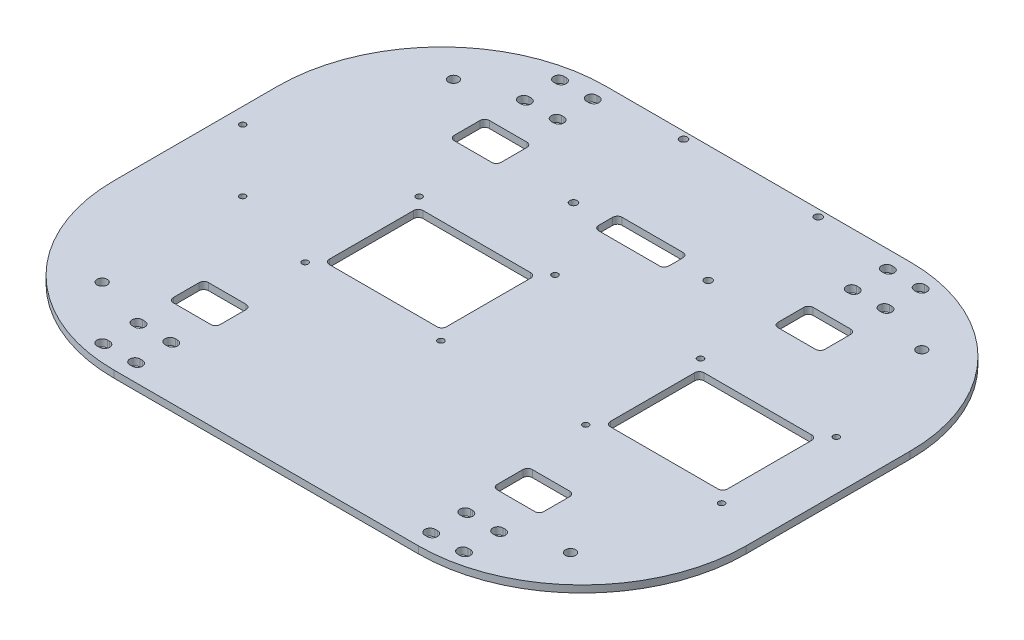
from build123d import *

# Parameters (mm, degrees)
SKETCH_1_W          = 270
SKETCH_1_H          = 210
EXTRUDE_1_DEPTH     = 3
SKETCH_2_R          = 2.15
CUT_EXTRUDE_1_DEPTH = 3
CUT_EXTRUDE_2_DEPTH = 10
SKETCH_4_W          = 20
SKETCH_4_H          = 15
CUT_EXTRUDE_3_DEPTH = 10
SKETCH_5_R          = 1.3
SKETCH_5_R_2        = 1.6
SKETCH_5_W          = 30
SKETCH_5_H          = 10
CUT_EXTRUDE_4_DEPTH = 10
CUT_EXTRUDE_5_DEPTH = 10
SKETCH_7_W          = 50
SKETCH_7_H          = 40
CUT_EXTRUDE_6_DEPTH = 10
FILLET_1_R          = 2


with BuildPart() as part:
    # 草图1 → 凸台-拉伸1 (new body)
    with BuildSketch(Plane(origin=(0, 0, 0), x_dir=(1, 0, 0), z_dir=(0, 1, 0))):
        Rectangle(SKETCH_1_W, SKETCH_1_H)
    extrude(amount=EXTRUDE_1_DEPTH)

    # 草图2 → 切除-拉伸1 (cut)
    with BuildSketch(Plane(origin=(0, 3, 0), x_dir=(1, 0, 0), z_dir=(0, 1, 0))):
        with Locations(Location((-100, 75, 0), (0, 0, 270))):
            Circle(SKETCH_2_R)
        with Locations(Location((100, 75, 0), (0, 0, 270))):
            Circle(SKETCH_2_R)
        with Locations(Location((100, -75, 0), (0, 0, 270))):
            Circle(SKETCH_2_R)
        with Locations(Location((-100, -75, 0), (0, 0, 270))):
            Circle(SKETCH_2_R)
    extrude(amount=-CUT_EXTRUDE_1_DEPTH, mode=Mode.SUBTRACT)

    # 草图3 → 切除-拉伸2 (cut)
    with BuildSketch(Plane(origin=(0, 3, 0), x_dir=(1, 0, 0), z_dir=(0, 1, 0))):
        with BuildLine():
            Line((-77.5, -80.3), (-76.5, -80.3))
            ThreePointArc((-76.5, -80.3), (-74.3, -82.5), (-76.5, -84.7))
            Line((-76.5, -84.7), (-77.5, -84.7))
            ThreePointArc((-77.5, -84.7), (-79.7, -82.5), (-77.5, -80.3))
        make_face()
        with BuildLine():
            Line((-62.5, -80.3), (-63.5, -80.3))
            ThreePointArc((-63.5, -80.3), (-65.7, -82.5), (-63.5, -84.7))
            Line((-63.5, -84.7), (-62.5, -84.7))
            ThreePointArc((-62.5, -84.7), (-60.3, -82.5), (-62.5, -80.3))
        make_face()
        with BuildLine():
            Line((-77.5, -99.7), (-76.5, -99.7))
            ThreePointArc((-76.5, -99.7), (-74.3, -97.5), (-76.5, -95.3))
            Line((-76.5, -95.3), (-77.5, -95.3))
            ThreePointArc((-77.5, -95.3), (-79.7, -97.5), (-77.5, -99.7))
        make_face()
        with BuildLine():
            Line((-62.5, -99.7), (-63.5, -99.7))
            ThreePointArc((-63.5, -99.7), (-65.7, -97.5), (-63.5, -95.3))
            Line((-63.5, -95.3), (-62.5, -95.3))
            ThreePointArc((-62.5, -95.3), (-60.3, -97.5), (-62.5, -99.7))
        make_face()
        with BuildLine():
            Line((62.5, -99.7), (63.5, -99.7))
            ThreePointArc((63.5, -99.7), (65.7, -97.5), (63.5, -95.3))
            Line((63.5, -95.3), (62.5, -95.3))
            ThreePointArc((62.5, -95.3), (60.3, -97.5), (62.5, -99.7))
        make_face()
        with BuildLine():
            Line((77.5, -99.7), (76.5, -99.7))
            ThreePointArc((76.5, -99.7), (74.3, -97.5), (76.5, -95.3))
            Line((76.5, -95.3), (77.5, -95.3))
            ThreePointArc((77.5, -95.3), (79.7, -97.5), (77.5, -99.7))
        make_face()
        with BuildLine():
            Line((77.5, -80.3), (76.5, -80.3))
            ThreePointArc((76.5, -80.3), (74.3, -82.5), (76.5, -84.7))
            Line((76.5, -84.7), (77.5, -84.7))
            ThreePointArc((77.5, -84.7), (79.7, -82.5), (77.5, -80.3))
        make_face()
        with BuildLine():
            Line((62.5, -80.3), (63.5, -80.3))
            ThreePointArc((63.5, -80.3), (65.7, -82.5), (63.5, -84.7))
            Line((63.5, -84.7), (62.5, -84.7))
            ThreePointArc((62.5, -84.7), (60.3, -82.5), (62.5, -80.3))
        make_face()
        with BuildLine():
            Line((-77.5, 80.3), (-76.5, 80.3))
            ThreePointArc((-76.5, 80.3), (-74.3, 82.5), (-76.5, 84.7))
            Line((-76.5, 84.7), (-77.5, 84.7))
            ThreePointArc((-77.5, 84.7), (-79.7, 82.5), (-77.5, 80.3))
        make_face()
        with BuildLine():
            Line((-62.5, 80.3), (-63.5, 80.3))
            ThreePointArc((-63.5, 80.3), (-65.7, 82.5), (-63.5, 84.7))
            Line((-63.5, 84.7), (-62.5, 84.7))
            ThreePointArc((-62.5, 84.7), (-60.3, 82.5), (-62.5, 80.3))
        make_face()
        with BuildLine():
            Line((-77.5, 99.7), (-76.5, 99.7))
            ThreePointArc((-76.5, 99.7), (-74.3, 97.5), (-76.5, 95.3))
            Line((-76.5, 95.3), (-77.5, 95.3))
            ThreePointArc((-77.5, 95.3), (-79.7, 97.5), (-77.5, 99.7))
        make_face()
        with BuildLine():
            Line((-62.5, 99.7), (-63.5, 99.7))
            ThreePointArc((-63.5, 99.7), (-65.7, 97.5), (-63.5, 95.3))
            Line((-63.5, 95.3), (-62.5, 95.3))
            ThreePointArc((-62.5, 95.3), (-60.3, 97.5), (-62.5, 99.7))
        make_face()
        with BuildLine():
            Line((62.5, 99.7), (63.5, 99.7))
            ThreePointArc((63.5, 99.7), (65.7, 97.5), (63.5, 95.3))
            Line((63.5, 95.3), (62.5, 95.3))
            ThreePointArc((62.5, 95.3), (60.3, 97.5), (62.5, 99.7))
        make_face()
        with BuildLine():
            Line((77.5, 99.7), (76.5, 99.7))
            ThreePointArc((76.5, 99.7), (74.3, 97.5), (76.5, 95.3))
            Line((76.5, 95.3), (77.5, 95.3))
            ThreePointArc((77.5, 95.3), (79.7, 97.5), (77.5, 99.7))
        make_face()
        with BuildLine():
            Line((77.5, 80.3), (76.5, 80.3))
            ThreePointArc((76.5, 80.3), (74.3, 82.5), (76.5, 84.7))
            Line((76.5, 84.7), (77.5, 84.7))
            ThreePointArc((77.5, 84.7), (79.7, 82.5), (77.5, 80.3))
        make_face()
        with BuildLine():
            Line((62.5, 80.3), (63.5, 80.3))
            ThreePointArc((63.5, 80.3), (65.7, 82.5), (63.5, 84.7))
            Line((63.5, 84.7), (62.5, 84.7))
            ThreePointArc((62.5, 84.7), (60.3, 82.5), (62.5, 80.3))
        make_face()
    extrude(amount=-CUT_EXTRUDE_2_DEPTH, mode=Mode.SUBTRACT)

    # 草图4 → 切除-拉伸3 (cut)
    with BuildSketch(Plane(origin=(0, 3, 0), x_dir=(1, 0, 0), z_dir=(0, 1, 0))):
        with Locations((-69.133090168, -59.966909832)):
            Rectangle(SKETCH_4_W, SKETCH_4_H)
        with Locations((69.133090168, -59.966909832)):
            Rectangle(SKETCH_4_W, SKETCH_4_H)
        with Locations((69.133090168, 59.966909832)):
            Rectangle(SKETCH_4_W, SKETCH_4_H)
        with Locations((-69.133090168, 59.966909832)):
            Rectangle(SKETCH_4_W, SKETCH_4_H)
    extrude(amount=-CUT_EXTRUDE_3_DEPTH, mode=Mode.SUBTRACT)

    # 草图5 → 切除-拉伸4 (cut)
    with BuildSketch(Plane(origin=(0, 3, 0), x_dir=(1, 0, 0), z_dir=(0, 1, 0))):
        with Locations(Location((-64, 24.35, 0), (0, 0, 270))):
            Circle(SKETCH_5_R)
        with Locations(Location((-6, 24.35, 0), (0, 0, 270))):
            Circle(SKETCH_5_R)
        with Locations(Location((56, 24.5, 0), (0, 0, 270))):
            Circle(SKETCH_5_R)
        with Locations(Location((114, 24.5, 0), (0, 0, 270))):
            Circle(SKETCH_5_R)
        with Locations(Location((114, -24.5, 0), (0, 0, 270))):
            Circle(SKETCH_5_R)
        with Locations(Location((56, -24.5, 0), (0, 0, 270))):
            Circle(SKETCH_5_R)
        with Locations(Location((-6, -24.35, 0), (0, 0, 270))):
            Circle(SKETCH_5_R)
        with Locations(Location((-64, -24.35, 0), (0, 0, 270))):
            Circle(SKETCH_5_R)
        with Locations(Location((-28.75, 102, 0), (0, 0, 270))):
            Circle(SKETCH_5_R_2)
        with Locations(Location((28.75, 102, 0), (0, 0, 270))):
            Circle(SKETCH_5_R_2)
        with Locations(Location((28.75, 55, 0), (0, 0, 270))):
            Circle(SKETCH_5_R_2)
        with Locations(Location((-28.75, 55, 0), (0, 0, 270))):
            Circle(SKETCH_5_R_2)
        with Locations(Location((-128.258252147, 13.258252147, 0), (0, 0, 270))):
            Circle(SKETCH_5_R)
        with Locations(Location((-101.741747853, -13.258252147, 0), (0, 0, 270))):
            Circle(SKETCH_5_R)
        with Locations((0, 55)):
            Rectangle(SKETCH_5_W, SKETCH_5_H)
    extrude(amount=-CUT_EXTRUDE_4_DEPTH, mode=Mode.SUBTRACT)

    # 草图6 → 切除-拉伸5 (cut)
    with BuildSketch(Plane(origin=(0, 3, 0), x_dir=(1, 0, 0), z_dir=(0, 1, 0))):
        with BuildLine():
            Line((-65, 105), (-135, 105))
            Line((-135, 105), (-135, 35))
            ThreePointArc((-135, 35), (-114.497474683, 84.497474683), (-65, 105))
        make_face()
        with BuildLine():
            Line((-135, -105), (-135, -35))
            ThreePointArc((-135, -35), (-114.497474683, -84.497474683), (-65, -105))
            Line((-65, -105), (-135, -105))
        make_face()
        with BuildLine():
            Line((65, -105), (135, -105))
            Line((135, -105), (135, -35))
            ThreePointArc((135, -35), (114.497474683, -84.497474683), (65, -105))
        make_face()
        with BuildLine():
            Line((135, 105), (135, 35))
            ThreePointArc((135, 35), (114.497474683, 84.497474683), (65, 105))
            Line((65, 105), (135, 105))
        make_face()
    extrude(amount=-CUT_EXTRUDE_5_DEPTH, mode=Mode.SUBTRACT)

    # 草图7 → 切除-拉伸6 (cut)
    with BuildSketch(Plane(origin=(0, 3, 0), x_dir=(1, 0, 0), z_dir=(0, 1, 0))):
        with Locations((-35, 0)):
            Rectangle(SKETCH_7_W, SKETCH_7_H)
        with Locations((85, 0)):
            Rectangle(SKETCH_7_W, SKETCH_7_H)
    extrude(amount=-CUT_EXTRUDE_6_DEPTH, mode=Mode.SUBTRACT)

    # 圆角1
    fillet_1_edges = [part.edges().sort_by_distance(p)[0] for p in [
        (-59.133090168, 1.5, -52.466909832),
        (-79.133090168, 1.5, -52.466909832),
        (-79.133090168, 1.5, -67.466909832),
        (-59.133090168, 1.5, -67.466909832),
        (79.133090168, 1.5, -67.466909832),
        (79.133090168, 1.5, -52.466909832),
        (59.133090168, 1.5, -52.466909832),
        (59.133090168, 1.5, -67.466909832),
        (59.133090168, 1.5, 52.466909832),
        (79.133090168, 1.5, 52.466909832),
        (79.133090168, 1.5, 67.466909832),
        (59.133090168, 1.5, 67.466909832),
        (-79.133090168, 1.5, 67.466909832),
        (-79.133090168, 1.5, 52.466909832),
        (-59.133090168, 1.5, 52.466909832),
        (-59.133090168, 1.5, 67.466909832),
        (15, 1.5, -60),
        (15, 1.5, -50),
        (-15, 1.5, -50),
        (-15, 1.5, -60),
        (-60, 1.5, 20),
        (-60, 1.5, -20),
        (-10, 1.5, -20),
        (-10, 1.5, 20),
        (110, 1.5, -20),
        (110, 1.5, 20),
        (60, 1.5, 20),
        (60, 1.5, -20),
    ]]
    fillet(fillet_1_edges, radius=FILLET_1_R)


solid = part.part
